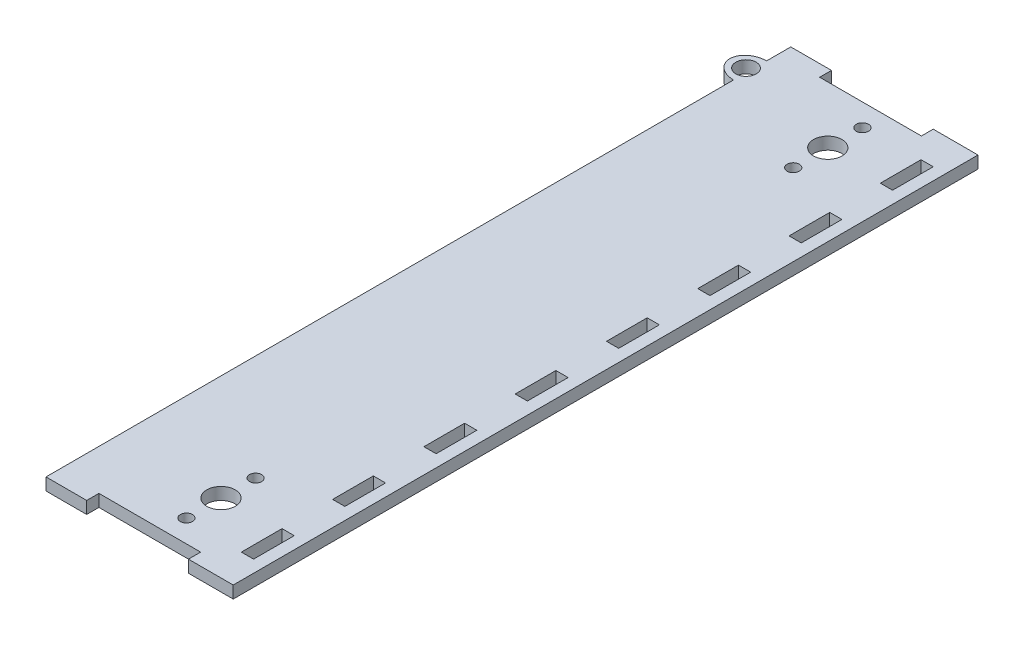
from build123d import *

# Parameters (mm, degrees)
SKETCH1_R           = 2.5
SKETCH1_R_2         = 3.5
SKETCH1_R_3         = 1.5
SKETCH1_W           = 3
SKETCH1_H           = 10
BOSS_EXTRUDE3_DEPTH = 3


with BuildPart() as part:
    # Sketch1 → Boss-Extrude3 (new body)
    with BuildSketch(Plane(origin=(0, 0, 0), x_dir=(1, 0, 0), z_dir=(0, 1, 0))):
        with BuildLine():
            Line((36.277091695, 79.255784564), (46.277091695, 79.255784564))
            Line((46.277091695, 79.255784564), (46.277091695, 76.347710002))
            Line((46.277091695, 76.347710002), (71.277091695, 76.347710002))
            Line((71.277091695, 76.347710002), (71.277091695, 79.255784564))
            Line((71.277091695, 79.255784564), (82.277091695, 79.255784564))
            Line((82.277091695, 79.255784564), (82.277091695, -103.744215436))
            Line((82.277091695, -103.744215436), (71.277091695, -103.744215436))
            Line((71.277091695, -103.744215436), (71.277091695, -100.744215436))
            Line((71.277091695, -100.744215436), (46.277091695, -100.744215436))
            Line((46.277091695, -100.744215436), (46.277091695, -103.744215436))
            Line((46.277091695, -103.744215436), (36.277091695, -103.744215436))
            Line((36.277091695, -103.744215436), (36.277091695, 65.194662811))
            add(Edge.make_bspline(
                [(36.277091695, 73.316906316), (31.289085945, 73.316906316), (31.289085945, 69.255784564), (31.289085945, 65.194662811), (36.277091695, 65.194662811)],
                knots=[4.71238898, 4.71238898, 4.71238898, 6.283185307, 6.283185307, 7.853981634, 7.853981634, 7.853981634], degree=2, weights=[1, 0.707106781, 1, 0.707106781, 1]))
            Line((36.277091695, 73.316906316), (36.277091695, 79.255784564))
        make_face()
        with Locations(Location((35.277091695, 69.255784564, 0), (0, 0, 270))):
            Circle(SKETCH1_R, mode=Mode.SUBTRACT)
        with Locations(Location((62.277091695, 62.347710002, 0), (0, 0, 270))):
            Circle(SKETCH1_R_2, mode=Mode.SUBTRACT)
        with Locations(Location((62.277091695, 70.847710002, 0), (0, 0, 270))):
            Circle(SKETCH1_R_3, mode=Mode.SUBTRACT)
        with Locations(Location((62.277091695, 53.847710002, 0), (0, 0, 270))):
            Circle(SKETCH1_R_3, mode=Mode.SUBTRACT)
        with Locations(Location((62.277091695, -86.744215436, 0), (0, 0, 270))):
            Circle(SKETCH1_R_2, mode=Mode.SUBTRACT)
        with Locations(Location((62.277091695, -78.244215436, 0), (0, 0, 270))):
            Circle(SKETCH1_R_3, mode=Mode.SUBTRACT)
        with Locations(Location((62.277091695, -95.244215436, 0), (0, 0, 270))):
            Circle(SKETCH1_R_3, mode=Mode.SUBTRACT)
        with Locations((77.777091695, 43.827213135)):
            Rectangle(SKETCH1_W, SKETCH1_H, mode=Mode.SUBTRACT)
        with Locations((77.777091695, 66.255784564)):
            Rectangle(SKETCH1_W, SKETCH1_H, mode=Mode.SUBTRACT)
        with Locations((77.777091695, 21.398641707)):
            Rectangle(SKETCH1_W, SKETCH1_H, mode=Mode.SUBTRACT)
        with Locations((77.777091695, -1.029929722)):
            Rectangle(SKETCH1_W, SKETCH1_H, mode=Mode.SUBTRACT)
        with Locations((77.777091695, -23.458501151)):
            Rectangle(SKETCH1_W, SKETCH1_H, mode=Mode.SUBTRACT)
        with Locations((77.777091695, -45.887072579)):
            Rectangle(SKETCH1_W, SKETCH1_H, mode=Mode.SUBTRACT)
        with Locations((77.777091695, -68.315644008)):
            Rectangle(SKETCH1_W, SKETCH1_H, mode=Mode.SUBTRACT)
        with Locations((77.777091695, -90.744215436)):
            Rectangle(SKETCH1_W, SKETCH1_H, mode=Mode.SUBTRACT)
    extrude(amount=BOSS_EXTRUDE3_DEPTH)


solid = part.part
